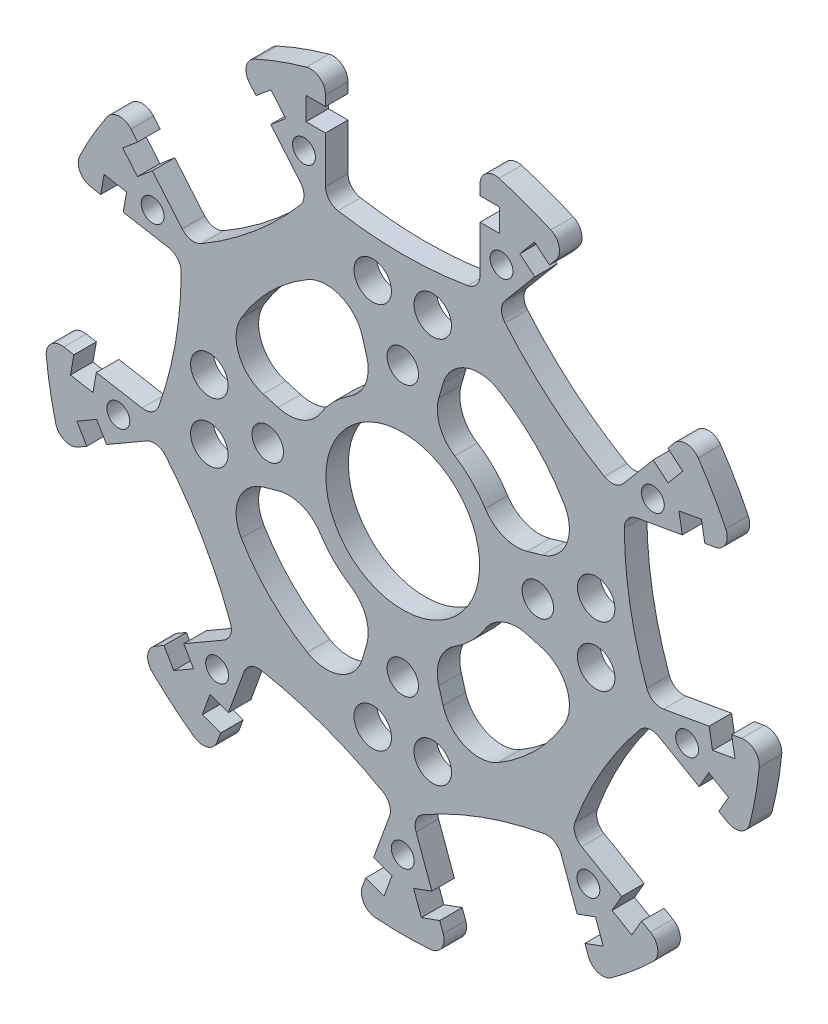
from build123d import *

# Parameters (mm, degrees)
SKETCH_1_R                       = 47.75
EXTRUDE_1_DEPTH                  = 3
CUT_EXTRUDE_1_DEPTH              = 68.595303091
FILLET_2_R                       = 2
SKETCH_3_R                       = 1.525
CUT_EXTRUDE_2_DEPTH              = 68.441458022
SKETCH_4_R                       = 2.1
SKETCH_4_R_2                     = 10.25
CUT_EXTRUDE_3_DEPTH              = 68.441458022
CUT_EXTRUDE_4_DEPTH              = 68.441458022
FILLET_3_R                       = 5
PATTERN_CIRCULAR_1_COUNT         = 4
FILLET_3_OF_PATTERN_CIRCULAR_1_R = 5
SKETCH_8_R                       = 2.5
CUT_EXTRUDE_5_DEPTH              = 68.441458022
PATTERN_CIRCULAR_2_COUNT         = 4


with BuildPart() as part:
    # ｽｹｯﾁ1 → ﾎﾞｽ - 押し出し1 (new body)
    with BuildSketch(Plane.XY):
        Circle(SKETCH_1_R)
    extrude(amount=EXTRUDE_1_DEPTH)

    # ｽｹｯﾁ2 → ｶｯﾄ - 押し出し1 (cut, through all)
    with BuildSketch(Plane.XY.offset(3)):
        with BuildLine():
            Line((-10.3, 46.625878008), (-10.3, 42.705))
            Line((-10.3, 42.705), (-12.9, 42.705))
            Line((-12.9, 42.705), (-12.9, 39.655))
            Line((-12.9, 39.655), (-10.3, 39.655))
            Line((-10.3, 39.655), (-10.3, 31.825692416))
            ThreePointArc((-10.3, 31.825692416), (0, 30.78), (10.3, 31.825692416))
            Line((10.3, 31.825692416), (10.3, 39.655))
            Line((10.3, 39.655), (12.9, 39.655))
            Line((12.9, 39.655), (12.9, 42.705))
            Line((12.9, 42.705), (10.3, 42.705))
            Line((10.3, 42.705), (10.3, 46.625878008))
            ThreePointArc((10.3, 46.625878008), (0, 47.75), (-10.3, 46.625878008))
        make_face()
        with BuildLine():
            Line((17.599484898, 36.998204772), (12.566902991, 31.000607203))
            ThreePointArc((12.566902991, 31.000607203), (19.785002626, 23.578847959), (28.347418519, 17.759182444))
            Line((28.347418519, 17.759182444), (33.380000426, 23.756780012))
            Line((33.380000426, 23.756780012), (35.371715978, 22.085532227))
            Line((35.371715978, 22.085532227), (37.332218188, 24.421967778))
            Line((37.332218188, 24.421967778), (35.340502636, 26.093215564))
            Line((35.340502636, 26.093215564), (37.860794438, 29.096782374))
            ThreePointArc((37.860794438, 29.096782374), (30.693108363, 36.578622159), (22.08027891, 42.338207133))
            Line((22.08027891, 42.338207133), (19.559987108, 39.334640323))
            Line((19.559987108, 39.334640323), (17.568271555, 41.005888108))
            Line((17.568271555, 41.005888108), (15.607769346, 38.669452557))
            Line((15.607769346, 38.669452557), (17.599484898, 36.998204772))
        make_face()
        with BuildLine():
            Line((37.263975216, 17.029538341), (29.553612406, 15.669993347))
            ThreePointArc((29.553612406, 15.669993347), (30.312382638, 5.344890909), (33.130764866, -4.617046365))
            Line((33.130764866, -4.617046365), (40.841127676, -3.257501371))
            Line((40.841127676, -3.257501371), (41.292612938, -5.818001528))
            Line((41.292612938, -5.818001528), (44.296276584, -5.288374587))
            Line((44.296276584, -5.288374587), (43.844791322, -2.727874429))
            Line((43.844791322, -2.727874429), (47.706102383, -2.047021108))
            ThreePointArc((47.706102383, -2.047021108), (47.024570206, 8.291700484), (44.128949923, 18.240018604))
            Line((44.128949923, 18.240018604), (40.267638862, 17.559165283))
            Line((40.267638862, 17.559165283), (39.8161536, 20.119665441))
            Line((39.8161536, 20.119665441), (36.812489954, 19.590038499))
            Line((36.812489954, 19.590038499), (37.263975216, 17.029538341))
        make_face()
        with BuildLine():
            Line((39.492237387, -10.907438341), (32.711858125, -6.992784549))
            ThreePointArc((32.711858125, -6.992784549), (26.656261928, -15.39), (22.411858125, -24.832907867))
            Line((22.411858125, -24.832907867), (29.192237387, -28.747561659))
            Line((29.192237387, -28.747561659), (27.892237387, -30.999227709))
            Line((27.892237387, -30.999227709), (30.533614869, -32.524227709))
            Line((30.533614869, -32.524227709), (31.833614869, -30.272561659))
            Line((31.833614869, -30.272561659), (35.229194829, -32.233000663))
            ThreePointArc((35.229194829, -32.233000663), (41.352713031, -23.875), (45.529194829, -14.392877345))
            Line((45.529194829, -14.392877345), (42.133614869, -12.432438341))
            Line((42.133614869, -12.432438341), (43.433614869, -10.180772291))
            Line((43.433614869, -10.180772291), (40.792237387, -8.655772291))
            Line((40.792237387, -8.655772291), (39.492237387, -10.907438341))
        make_face()
        with BuildLine():
            Line((23.241642778, -33.740703401), (20.563861876, -26.383560838))
            ThreePointArc((20.563861876, -26.383560838), (10.527380012, -28.923738868), (1.206193887, -33.429175791))
            Line((1.206193887, -33.429175791), (3.883974789, -40.786318354))
            Line((3.883974789, -40.786318354), (1.440773975, -41.675570726))
            Line((1.440773975, -41.675570726), (2.483935413, -44.54163322))
            Line((2.483935413, -44.54163322), (4.927136227, -43.652380847))
            Line((4.927136227, -43.652380847), (6.268155485, -47.336800978))
            ThreePointArc((6.268155485, -47.336800978), (16.331461844, -44.870322643), (25.625823473, -40.291186025))
            Line((25.625823473, -40.291186025), (24.284804215, -36.606765894))
            Line((24.284804215, -36.606765894), (26.728005029, -35.717513522))
            Line((26.728005029, -35.717513522), (25.684843592, -32.851451028))
            Line((25.684843592, -32.851451028), (23.241642778, -33.740703401))
        make_face()
        with BuildLine():
            Line((-3.883974789, -40.786318354), (-1.206193887, -33.429175791))
            ThreePointArc((-1.206193887, -33.429175791), (-10.527380012, -28.923738868), (-20.563861876, -26.383560838))
            Line((-20.563861876, -26.383560838), (-23.241642778, -33.740703401))
            Line((-23.241642778, -33.740703401), (-25.684843592, -32.851451028))
            Line((-25.684843592, -32.851451028), (-26.728005029, -35.717513522))
            Line((-26.728005029, -35.717513522), (-24.284804215, -36.606765894))
            Line((-24.284804215, -36.606765894), (-25.625823473, -40.291186025))
            ThreePointArc((-25.625823473, -40.291186025), (-16.331461844, -44.870322643), (-6.268155485, -47.336800978))
            Line((-6.268155485, -47.336800978), (-4.927136227, -43.652380847))
            Line((-4.927136227, -43.652380847), (-2.483935413, -44.54163322))
            Line((-2.483935413, -44.54163322), (-1.440773975, -41.675570726))
            Line((-1.440773975, -41.675570726), (-3.883974789, -40.786318354))
        make_face()
        with BuildLine():
            Line((-29.192237387, -28.747561659), (-22.411858125, -24.832907867))
            ThreePointArc((-22.411858125, -24.832907867), (-26.656261928, -15.39), (-32.711858125, -6.992784549))
            Line((-32.711858125, -6.992784549), (-39.492237387, -10.907438341))
            Line((-39.492237387, -10.907438341), (-40.792237387, -8.655772291))
            Line((-40.792237387, -8.655772291), (-43.433614869, -10.180772291))
            Line((-43.433614869, -10.180772291), (-42.133614869, -12.432438341))
            Line((-42.133614869, -12.432438341), (-45.529194829, -14.392877345))
            ThreePointArc((-45.529194829, -14.392877345), (-41.352713031, -23.875), (-35.229194829, -32.233000663))
            Line((-35.229194829, -32.233000663), (-31.833614869, -30.272561659))
            Line((-31.833614869, -30.272561659), (-30.533614869, -32.524227709))
            Line((-30.533614869, -32.524227709), (-27.892237387, -30.999227709))
            Line((-27.892237387, -30.999227709), (-29.192237387, -28.747561659))
        make_face()
        with BuildLine():
            Line((-40.841127676, -3.257501371), (-33.130764866, -4.617046365))
            ThreePointArc((-33.130764866, -4.617046365), (-30.312382638, 5.344890909), (-29.553612406, 15.669993347))
            Line((-29.553612406, 15.669993347), (-37.263975216, 17.029538341))
            Line((-37.263975216, 17.029538341), (-36.812489954, 19.590038499))
            Line((-36.812489954, 19.590038499), (-39.8161536, 20.119665441))
            Line((-39.8161536, 20.119665441), (-40.267638862, 17.559165283))
            Line((-40.267638862, 17.559165283), (-44.128949923, 18.240018604))
            ThreePointArc((-44.128949923, 18.240018604), (-47.024570206, 8.291700484), (-47.706102383, -2.047021108))
            Line((-47.706102383, -2.047021108), (-43.844791322, -2.727874429))
            Line((-43.844791322, -2.727874429), (-44.296276584, -5.288374587))
            Line((-44.296276584, -5.288374587), (-41.292612938, -5.818001528))
            Line((-41.292612938, -5.818001528), (-40.841127676, -3.257501371))
        make_face()
        with BuildLine():
            Line((-33.380000426, 23.756780012), (-28.347418519, 17.759182444))
            ThreePointArc((-28.347418519, 17.759182444), (-19.785002626, 23.578847959), (-12.566902991, 31.000607203))
            Line((-12.566902991, 31.000607203), (-17.599484898, 36.998204772))
            Line((-17.599484898, 36.998204772), (-15.607769346, 38.669452557))
            Line((-15.607769346, 38.669452557), (-17.568271555, 41.005888108))
            Line((-17.568271555, 41.005888108), (-19.559987108, 39.334640323))
            Line((-19.559987108, 39.334640323), (-22.08027891, 42.338207133))
            ThreePointArc((-22.08027891, 42.338207133), (-30.693108363, 36.578622159), (-37.860794438, 29.096782374))
            Line((-37.860794438, 29.096782374), (-35.340502636, 26.093215564))
            Line((-35.340502636, 26.093215564), (-37.332218188, 24.421967778))
            Line((-37.332218188, 24.421967778), (-35.371715978, 22.085532227))
            Line((-35.371715978, 22.085532227), (-33.380000426, 23.756780012))
        make_face()
    extrude(amount=-CUT_EXTRUDE_1_DEPTH, mode=Mode.SUBTRACT)

    # ﾌｨﾚｯﾄ2
    fillet_2_edges = [part.edges().sort_by_distance(p)[0] for p in [
        (-47.706102383, -2.047021108, 1.5),
        (-44.128949923, 18.240018604, 1.5),
        (-29.553612406, 15.669993347, 1.5),
        (-33.130764866, -4.617046365, 1.5),
        (-37.860794438, 29.096782374, 1.5),
        (-22.08027891, 42.338207133, 1.5),
        (-12.566902991, 31.000607203, 1.5),
        (-28.347418519, 17.759182444, 1.5),
        (-6.268155485, -47.336800978, 1.5),
        (-25.625823473, -40.291186025, 1.5),
        (-20.563861876, -26.383560838, 1.5),
        (-1.206193887, -33.429175791, 1.5),
        (-35.229194829, -32.233000663, 1.5),
        (-45.529194829, -14.392877345, 1.5),
        (-32.711858125, -6.992784549, 1.5),
        (-22.411858125, -24.832907867, 1.5),
        (45.529194829, -14.392877345, 1.5),
        (35.229194829, -32.233000663, 1.5),
        (22.411858125, -24.832907867, 1.5),
        (32.711858125, -6.992784549, 1.5),
        (25.625823473, -40.291186025, 1.5),
        (6.268155485, -47.336800978, 1.5),
        (1.206193887, -33.429175791, 1.5),
        (20.563861876, -26.383560838, 1.5),
        (22.08027891, 42.338207133, 1.5),
        (37.860794438, 29.096782374, 1.5),
        (28.347418519, 17.759182444, 1.5),
        (12.566902991, 31.000607203, 1.5),
        (44.128949923, 18.240018604, 1.5),
        (47.706102383, -2.047021108, 1.5),
        (33.130764866, -4.617046365, 1.5),
        (29.553612406, 15.669993347, 1.5),
        (-10.3, 46.625878008, 1.5),
        (10.3, 46.625878008, 1.5),
        (10.3, 31.825692416, 1.5),
        (-10.3, 31.825692416, 1.5),
    ]]
    fillet(fillet_2_edges, radius=FILLET_2_R)

    # ｽｹｯﾁ3 → ｶｯﾄ - 押し出し2 (cut, through all)
    with BuildSketch(Plane.XY.offset(3)):
        with Locations((0, -38.5)):
            Circle(SKETCH_3_R)
        with Locations((-24.747322973, -29.49271106)):
            Circle(SKETCH_3_R)
        with Locations((-37.915098491, -6.68545484)):
            Circle(SKETCH_3_R)
        with Locations((-33.341978046, 19.25)):
            Circle(SKETCH_3_R)
        with Locations((-13.167775518, 36.1781659)):
            Circle(SKETCH_3_R)
        with Locations((13.167775518, 36.1781659)):
            Circle(SKETCH_3_R)
        with Locations((33.341978046, 19.25)):
            Circle(SKETCH_3_R)
        with Locations((37.915098491, -6.68545484)):
            Circle(SKETCH_3_R)
        with Locations((24.747322973, -29.49271106)):
            Circle(SKETCH_3_R)
    extrude(amount=-CUT_EXTRUDE_2_DEPTH, mode=Mode.SUBTRACT)

    # ｽｹｯﾁ4 → ｶｯﾄ - 押し出し3 (cut, through all)
    with BuildSketch(Plane(origin=(0, 0, 0), x_dir=(-1, 0, 0), z_dir=(0, 0, -1))):
        with Locations((18, 0)):
            Circle(SKETCH_4_R)
        with Locations((0, -18)):
            Circle(SKETCH_4_R)
        with Locations((0, 18)):
            Circle(SKETCH_4_R)
        Circle(SKETCH_4_R_2)
        with Locations((-18, 0)):
            Circle(SKETCH_4_R)
    extrude(amount=-CUT_EXTRUDE_3_DEPTH, mode=Mode.SUBTRACT)

    # ｽｹｯﾁ7 → ｶｯﾄ - 押し出し4 (cut, through all)
    with BuildSketch(Plane(origin=(0, 0, 0), x_dir=(-1, 0, 0), z_dir=(0, 0, -1))):
        with BuildLine():
            Line((-3.611111111, 12.48838967), (-6.944444444, 24.01613398))
            ThreePointArc((-6.944444444, 24.01613398), (-17.67766953, 17.67766953), (-24.01613398, 6.944444444))
            Line((-24.01613398, 6.944444444), (-12.48838967, 3.611111111))
            ThreePointArc((-12.48838967, 3.611111111), (-9.192388155, 9.192388155), (-3.611111111, 12.48838967))
        make_face()
    cut_extrude_4 = extrude(amount=-CUT_EXTRUDE_4_DEPTH, mode=Mode.SUBTRACT)

    # ﾌｨﾚｯﾄ3
    fillet_3_edges = [part.edges().sort_by_distance(p)[0] for p in [
        (3.611111111, 12.48838967, 1.5),
        (12.48838967, 3.611111111, 1.5),
        (24.01613398, 6.944444444, 1.5),
        (6.944444444, 24.01613398, 1.5),
    ]]
    fillet(fillet_3_edges, radius=FILLET_3_R)

    # 円形ﾊﾟﾀｰﾝ1: ｶｯﾄ - 押し出し4 ×4 about axis
    pattern_circular_1_axis = Axis((0, 0, 0), (0, 0, 1))
    for i in range(1, PATTERN_CIRCULAR_1_COUNT):
        add(cut_extrude_4.rotate(pattern_circular_1_axis, i * 360 / PATTERN_CIRCULAR_1_COUNT), mode=Mode.SUBTRACT)

    # ﾌｨﾚｯﾄ3 of 円形ﾊﾟﾀｰﾝ1
    fillet_3_of_pattern_circular_1_edges = [part.edges().sort_by_distance(p)[0] for p in [
        (-12.48838967, 3.611111111, 1.5),
        (-3.611111111, 12.48838967, 1.5),
        (-6.944444444, 24.01613398, 1.5),
        (-24.01613398, 6.944444444, 1.5),
        (-3.611111111, -12.48838967, 1.5),
        (-12.48838967, -3.611111111, 1.5),
        (-24.01613398, -6.944444444, 1.5),
        (-6.944444444, -24.01613398, 1.5),
        (12.48838967, -3.611111111, 1.5),
        (3.611111111, -12.48838967, 1.5),
        (6.944444444, -24.01613398, 1.5),
        (24.01613398, -6.944444444, 1.5),
    ]]
    fillet(fillet_3_of_pattern_circular_1_edges, radius=FILLET_3_OF_PATTERN_CIRCULAR_1_R)

    # ｽｹｯﾁ8 → ｶｯﾄ - 押し出し5 (cut, through all)
    with BuildSketch(Plane(origin=(0, 0, 0), x_dir=(-1, 0, 0), z_dir=(0, 0, -1))):
        with Locations((-4, 25.78)):
            Circle(SKETCH_8_R)
        with Locations((4, 25.78)):
            Circle(SKETCH_8_R)
    cut_extrude_5 = extrude(amount=-CUT_EXTRUDE_5_DEPTH, mode=Mode.SUBTRACT)

    # 円形ﾊﾟﾀｰﾝ2: ｶｯﾄ - 押し出し5 ×4 about axis
    pattern_circular_2_axis = Axis((0, 0, 0), (0, 0, 1))
    for i in range(1, PATTERN_CIRCULAR_2_COUNT):
        add(cut_extrude_5.rotate(pattern_circular_2_axis, i * 360 / PATTERN_CIRCULAR_2_COUNT), mode=Mode.SUBTRACT)


solid = part.part
